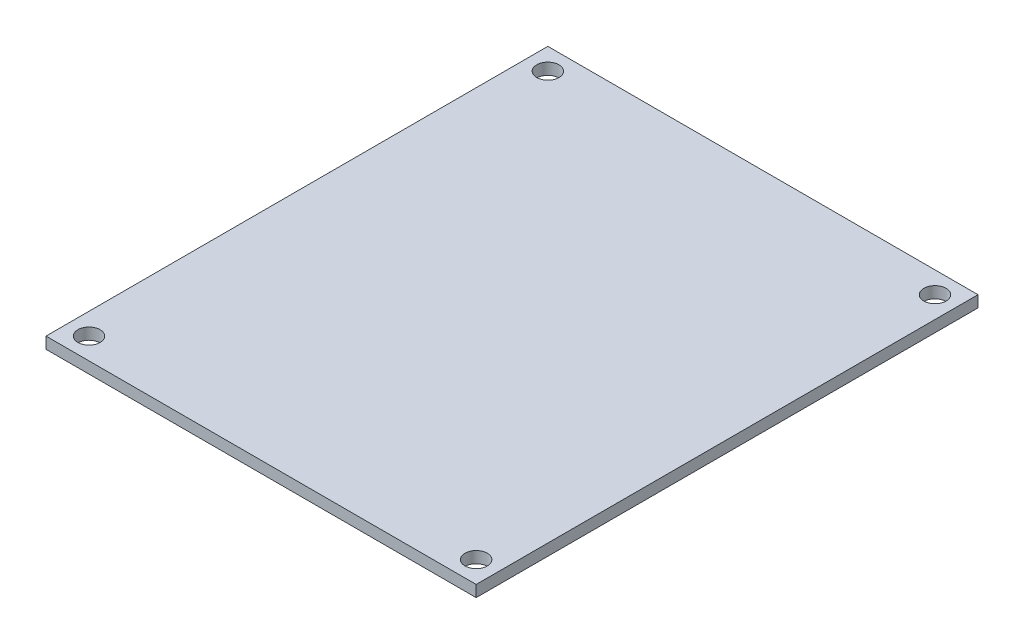
from build123d import *

# Parameters (mm, degrees)
SKETCH_1_W      = 60
SKETCH_1_H      = 70
SKETCH_1_R      = 1.55
EXTRUDE_1_DEPTH = 1.6


with BuildPart() as part:
    # 草图1 → 凸台-拉伸1 (new body)
    with BuildSketch(Plane(origin=(0, 0, 0), x_dir=(1, 0, 0), z_dir=(0, 1, 0))):
        Rectangle(SKETCH_1_W, SKETCH_1_H)
        with Locations(Location((27, 32, 0), (0, 0, 270))):
            Circle(SKETCH_1_R, mode=Mode.SUBTRACT)
        with Locations(Location((-27, 32, 0), (0, 0, 270))):
            Circle(SKETCH_1_R, mode=Mode.SUBTRACT)
        with Locations(Location((27, -32, 0), (0, 0, 270))):
            Circle(SKETCH_1_R, mode=Mode.SUBTRACT)
        with Locations(Location((-27, -32, 0), (0, 0, 270))):
            Circle(SKETCH_1_R, mode=Mode.SUBTRACT)
    extrude(amount=EXTRUDE_1_DEPTH)


solid = part.part
